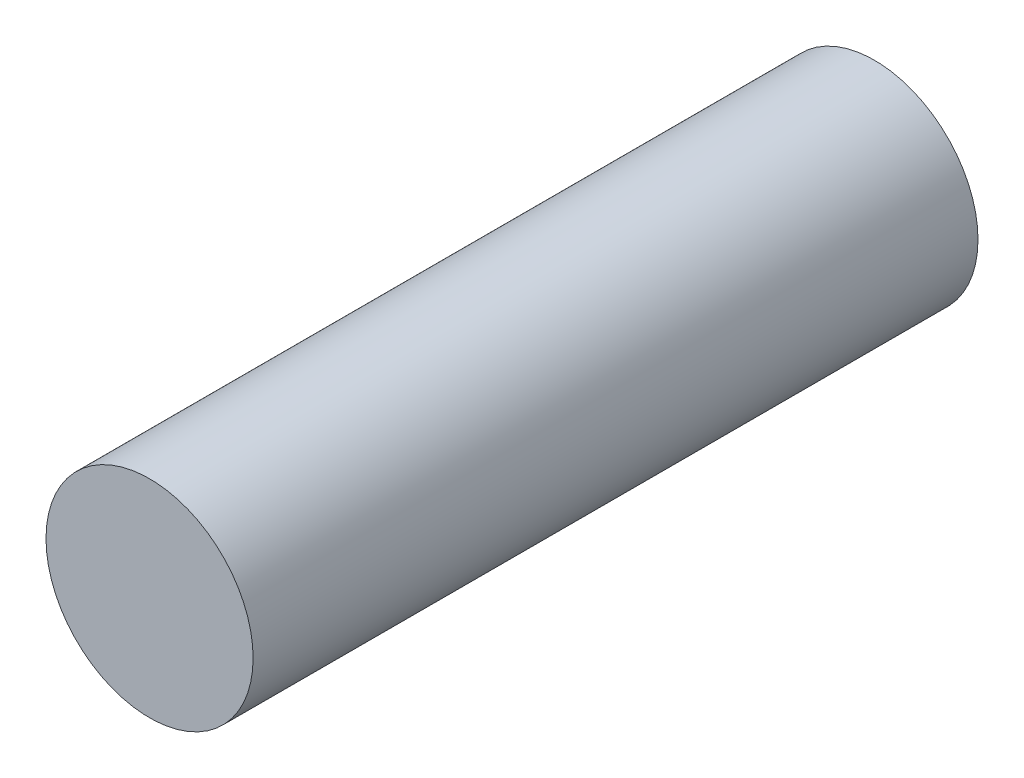
from build123d import *

# Parameters (mm, degrees)
SKETCH1_R           = 10
BOSS_EXTRUDE1_DEPTH = 70


with BuildPart() as part:
    # Sketch1 → Boss-Extrude1 (new body)
    with BuildSketch(Plane.XY):
        Circle(SKETCH1_R)
    extrude(amount=BOSS_EXTRUDE1_DEPTH)


solid = part.part
